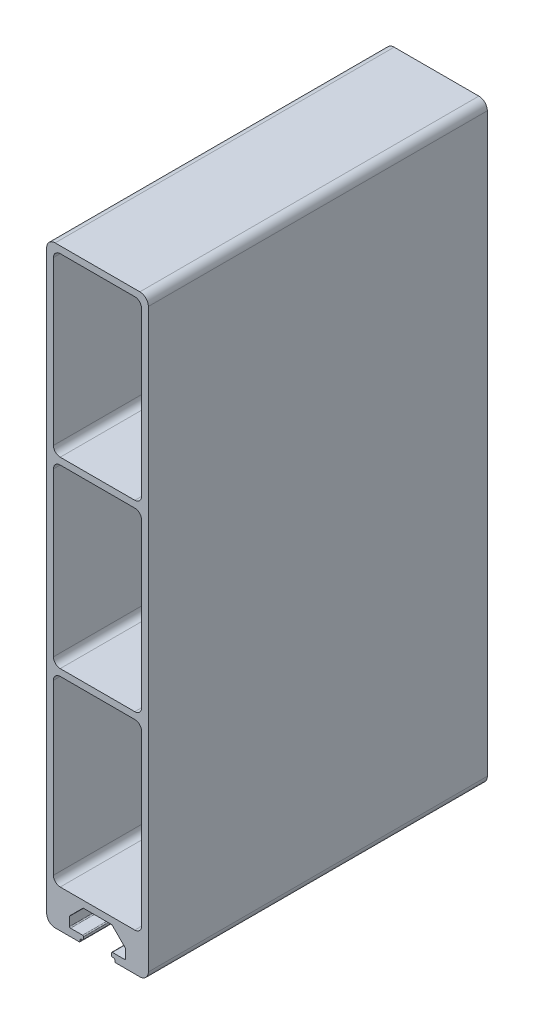
from build123d import *

# Parameters (mm, degrees)
EXTRUDE_1_DEPTH = 50


with BuildPart() as part:
    # 草图1 → 凸台-拉伸1 (new, symmetric)
    with BuildSketch(Plane.XY):
        with BuildLine():
            Line((12.49999999, 0), (-12.49999999, 0))
            ThreePointArc((-12.49999999, 0), (-14.267766942, -0.732233047), (-14.999999989, -2.499999998))
            Line((-14.999999989, -2.499999998), (-14.999999989, -172.500000002))
            ThreePointArc((-14.999999989, -172.500000002), (-14.267766942, -174.267766953), (-12.49999999, -175))
            Line((-12.49999999, -175), (-5.399999995, -175))
            ThreePointArc((-5.399999995, -175), (-5.187867961, -174.912132034), (-5.099999996, -174.7))
            Line((-5.099999996, -174.7), (-5.099999996, -174.300000001))
            ThreePointArc((-5.099999996, -174.300000001), (-5.01213203, -174.087867966), (-4.799999996, -174.000000001))
            Line((-4.799999996, -174.000000001), (-4.399999997, -174.000000001))
            ThreePointArc((-4.399999997, -174.000000001), (-4.187867962, -173.912132035), (-4.099999997, -173.700000001))
            Line((-4.099999997, -173.700000001), (-4.099999997, -173.100000001))
            ThreePointArc((-4.099999997, -173.100000001), (-4.187867962, -172.887867967), (-4.399999997, -172.800000002))
            Line((-4.399999997, -172.800000002), (-7.949999994, -172.800000002))
            ThreePointArc((-7.949999994, -172.800000002), (-8.162132028, -172.712132036), (-8.249999994, -172.500000002))
            Line((-8.249999994, -172.500000002), (-8.249999994, -169.929898991))
            ThreePointArc((-8.249999994, -169.929898991), (-8.227163853, -169.815093962), (-8.162132028, -169.717766957))
            Line((-8.162132028, -169.717766957), (-4.332233044, -165.887867973))
            ThreePointArc((-4.332233044, -165.887867973), (-4.234906039, -165.822836147), (-4.12010101, -165.800000007))
            Line((-4.12010101, -165.800000007), (4.12010101, -165.800000007))
            ThreePointArc((4.12010101, -165.800000007), (4.234906039, -165.822836147), (4.332233044, -165.887867973))
            Line((4.332233044, -165.887867973), (8.162132028, -169.717766957))
            ThreePointArc((8.162132028, -169.717766957), (8.227163854, -169.815093962), (8.249999994, -169.929898991))
            Line((8.249999994, -169.929898991), (8.249999994, -172.500000002))
            ThreePointArc((8.249999994, -172.500000002), (8.162132028, -172.712132036), (7.949999994, -172.800000002))
            Line((7.949999994, -172.800000002), (4.399999997, -172.800000002))
            ThreePointArc((4.399999997, -172.800000002), (4.187867963, -172.887867967), (4.099999997, -173.100000001))
            Line((4.099999997, -173.100000001), (4.099999997, -173.700000001))
            ThreePointArc((4.099999997, -173.700000001), (4.187867963, -173.912132035), (4.399999997, -174.000000001))
            Line((4.399999997, -174.000000001), (4.799999996, -174.000000001))
            ThreePointArc((4.799999996, -174.000000001), (5.01213203, -174.087867966), (5.099999996, -174.300000001))
            Line((5.099999996, -174.300000001), (5.099999996, -174.7))
            ThreePointArc((5.099999996, -174.7), (5.187867962, -174.912132034), (5.399999996, -175))
            Line((5.399999996, -175), (12.49999999, -175))
            ThreePointArc((12.49999999, -175), (14.267766942, -174.267766953), (14.999999989, -172.500000002))
            Line((14.999999989, -172.500000002), (14.999999989, -2.499999998))
            ThreePointArc((14.999999989, -2.499999998), (14.267766942, -0.732233047), (12.49999999, 0))
        make_face()
        with BuildLine():
            Line((10.999999989, -2), (-10.999999989, -2))
            ThreePointArc((-10.999999989, -2), (-12.414213551, -2.585786438), (-12.999999989, -4))
            Line((-12.999999989, -4), (-12.999999989, -52))
            ThreePointArc((-12.999999989, -52), (-12.414213551, -53.414213562), (-10.999999989, -54))
            Line((-10.999999989, -54), (10.999999989, -54))
            ThreePointArc((10.999999989, -54), (12.414213551, -53.414213562), (12.999999989, -52))
            Line((12.999999989, -52), (12.999999989, -4))
            ThreePointArc((12.999999989, -4), (12.414213551, -2.585786438), (10.999999989, -2))
        make_face(mode=Mode.SUBTRACT)
        with BuildLine():
            Line((10.999999989, -163.800000007), (-10.999999989, -163.800000007))
            ThreePointArc((-10.999999989, -163.800000007), (-12.414213551, -163.214213569), (-12.999999989, -161.800000007))
            Line((-12.999999989, -161.800000007), (-12.999999989, -112))
            ThreePointArc((-12.999999989, -112), (-12.414213551, -110.585786438), (-10.999999989, -110))
            Line((-10.999999989, -110), (10.999999989, -110))
            ThreePointArc((10.999999989, -110), (12.414213551, -110.585786438), (12.999999989, -112))
            Line((12.999999989, -112), (12.999999989, -161.800000007))
            ThreePointArc((12.999999989, -161.800000007), (12.414213551, -163.214213569), (10.999999989, -163.800000007))
        make_face(mode=Mode.SUBTRACT)
        with BuildLine():
            Line((-10.999999989, -56), (10.999999989, -56))
            ThreePointArc((10.999999989, -56), (12.414213551, -56.585786438), (12.999999989, -58))
            Line((12.999999989, -58), (12.999999989, -106))
            ThreePointArc((12.999999989, -106), (12.414213551, -107.414213562), (10.999999989, -108))
            Line((10.999999989, -108), (-10.999999989, -108))
            ThreePointArc((-10.999999989, -108), (-12.414213551, -107.414213562), (-12.999999989, -106))
            Line((-12.999999989, -106), (-12.999999989, -58))
            ThreePointArc((-12.999999989, -58), (-12.414213551, -56.585786438), (-10.999999989, -56))
        make_face(mode=Mode.SUBTRACT)
    extrude(amount=EXTRUDE_1_DEPTH, both=True)


solid = part.part
